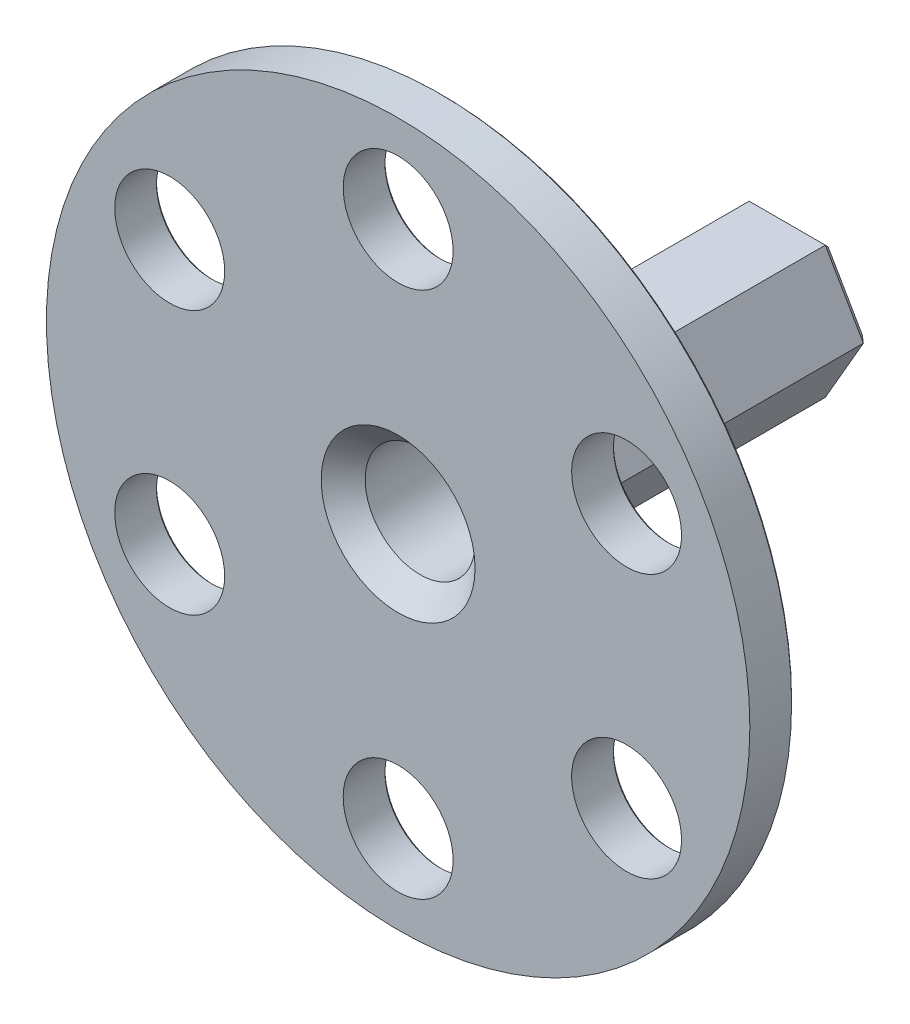
from build123d import *

# Parameters (mm, degrees)
SKETCH1_R           = 32
BOSS_EXTRUDE1_DEPTH = 4
SKETCH2_R           = 5
CUT_EXTRUDE1_DEPTH  = 46.431266766
CIRPATTERN1_COUNT   = 6
BOSS_EXTRUDE2_DEPTH = 32
CHAMFER1_SIZE       = 2
CHAMFER2_SIZE       = 0.2
SKETCH4_R           = 5
CUT_EXTRUDE2_DEPTH  = 32
CHAMFER3_SIZE       = 0.6
CHAMFER4_SIZE       = 5
CHAMFER5_SIZE       = 2
SCALE1_SCALE        = 0.4


with BuildPart() as part:
    # Sketch1 → Boss-Extrude1 (new body)
    with BuildSketch(Plane.XY):
        Circle(SKETCH1_R)
    extrude(amount=-BOSS_EXTRUDE1_DEPTH)

    # Sketch2 → Cut-Extrude1 (cut, through all)
    with BuildSketch(Plane.XY):
        with Locations((0, 24)):
            Circle(SKETCH2_R)
    cut_extrude1 = extrude(amount=-CUT_EXTRUDE1_DEPTH, mode=Mode.SUBTRACT)

    # CirPattern1: Cut-Extrude1 ×6 about axis
    cirpattern1_axis = Axis((0, 0, 0), (0, 0, 1))
    for i in range(1, CIRPATTERN1_COUNT):
        add(cut_extrude1.rotate(cirpattern1_axis, i * 360 / CIRPATTERN1_COUNT), mode=Mode.SUBTRACT)

    # Sketch3 → Boss-Extrude2 (add)
    with BuildSketch(Plane(origin=(0, 0, -4), x_dir=(-1, 0, 0), z_dir=(0, 0, -1))):
        Polygon((-3.464101615, 6), (-6.92820323, 0), (-3.464101615, -6), (3.464101615, -6), (6.92820323, 0), (3.464101615, 6), align=None)
    extrude(amount=BOSS_EXTRUDE2_DEPTH)

    # Chamfer1
    chamfer1_edges = [part.edges().sort_by_distance(p)[0] for p in [
        (0, 6, -4),
        (5.196152423, 3, -4),
        (5.196152423, -3, -4),
        (0, -6, -4),
        (-5.196152423, -3, -4),
        (-5.196152423, 3, -4),
    ]]
    chamfer(chamfer1_edges, length=CHAMFER1_SIZE)

    # Chamfer2
    chamfer2_edges = [part.edges().sort_by_distance(p)[0] for p in [
        (-23.284609691, 7.669872981, -4),
        (-18.284609691, -16.330127019, -4),
        (5, -24, -4),
        (23.284609691, -7.669872981, -4),
        (18.284609691, 16.330127019, -4),
        (-32, 0, -4),
        (-5, 24, -4),
    ]]
    chamfer(chamfer2_edges, length=CHAMFER2_SIZE)

    # Sketch4 → Cut-Extrude2 (cut)
    with BuildSketch(Plane.XY):
        Circle(SKETCH4_R)
    extrude(amount=-CUT_EXTRUDE2_DEPTH, mode=Mode.SUBTRACT)

    # Chamfer3
    chamfer3_edges = [part.edges().sort_by_distance(p)[0] for p in [
        (0, 6, -36),
        (5.196152423, 3, -36),
        (5.196152423, -3, -36),
        (0, -6, -36),
        (-5.196152423, -3, -36),
        (-5.196152423, 3, -36),
    ]]
    chamfer(chamfer3_edges, length=CHAMFER3_SIZE)

    # Chamfer4
    chamfer4_edges = [part.edges().sort_by_distance(p)[0] for p in [
        (-5, 0, -32),
    ]]
    chamfer(chamfer4_edges, length=CHAMFER4_SIZE)

    # Chamfer5
    chamfer5_edges = [part.edges().sort_by_distance(p)[0] for p in [
        (-5, 0, 0),
    ]]
    chamfer(chamfer5_edges, length=CHAMFER5_SIZE)


with BuildPart() as part_1:
    # Scale1: scaled about (0, 0, -5.463972753)
    add(part.part.scale(SCALE1_SCALE).moved(Location((0, 0, -3.278383652))))


solid = part_1.part
